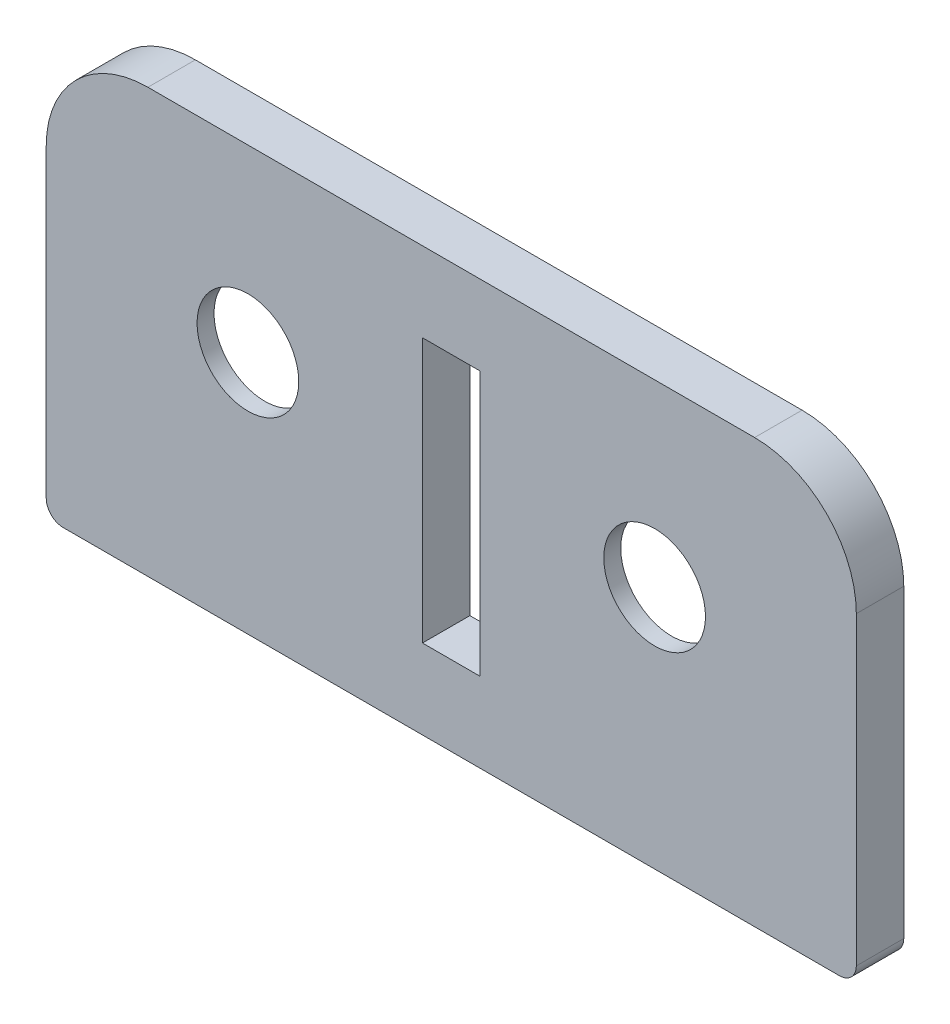
from build123d import *

# Parameters (mm, degrees)
SKICA1_W                 = 1.7
SKICA1_H                 = 7.8
SKICA1_R                 = 1.5
P_IDAT_VYSUNUT_M3_DEPTH  = 1.4
SKICA3_R                 = 3.986213299
ODEBRAT_VYSUNUT_M1_DEPTH = 0.9


with BuildPart() as part:
    # Skica1 → Přidat vysunutím3 (new body)
    with BuildSketch(Plane.XY):
        with BuildLine():
            Line((-11.45, -6.25), (11.45, -6.25))
            ThreePointArc((11.45, -6.25), (11.803553391, -6.103553391), (11.95, -5.75))
            Line((11.95, -5.75), (11.95, 3.25))
            ThreePointArc((11.95, 3.25), (11.071320344, 5.371320344), (8.95, 6.25))
            Line((8.95, 6.25), (-8.95, 6.25))
            ThreePointArc((-8.95, 6.25), (-11.071320344, 5.371320344), (-11.95, 3.25))
            Line((-11.95, 3.25), (-11.95, -5.75))
            ThreePointArc((-11.95, -5.75), (-11.803553391, -6.103553391), (-11.45, -6.25))
        make_face()
        Rectangle(SKICA1_W, SKICA1_H, mode=Mode.SUBTRACT)
        with Locations((-6, 0.95)):
            Circle(SKICA1_R, mode=Mode.SUBTRACT)
        with Locations((6, 0.95)):
            Circle(SKICA1_R, mode=Mode.SUBTRACT)
    extrude(amount=P_IDAT_VYSUNUT_M3_DEPTH)

    # Skica3 → Odebrat vysunutím1 (cut)
    with BuildSketch(Plane(origin=(0, 0, 0), x_dir=(-1, 0, 0), z_dir=(0, 0, -1))):
        with Locations((-6, 0.95)):
            Circle(SKICA3_R)
        with Locations((6, 0.95)):
            Circle(SKICA3_R)
    extrude(amount=-ODEBRAT_VYSUNUT_M1_DEPTH, mode=Mode.SUBTRACT)


solid = part.part
